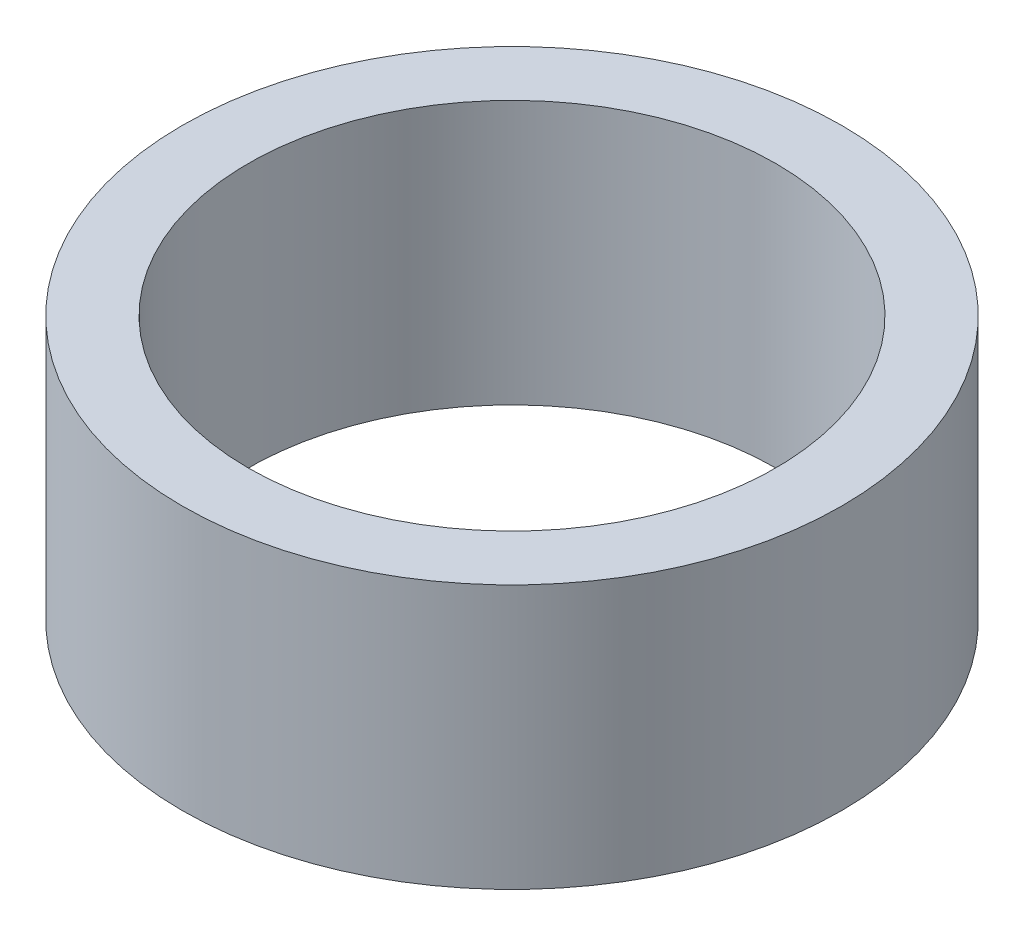
from build123d import *

# Parameters (mm, degrees)
SKETCH1_R           = 63.5
BOSS_EXTRUDE1_DEPTH = 50.8
SKETCH2_R           = 50.8
CUT_EXTRUDE1_DEPTH  = 104.175287739


with BuildPart() as part:
    # Sketch1 → Boss-Extrude1 (new body)
    with BuildSketch(Plane(origin=(0, 0, 0), x_dir=(1, 0, 0), z_dir=(0, 1, 0))):
        with Locations(Location((0, 0, 0), (0, 0, 270))):
            Circle(SKETCH1_R)
    extrude(amount=BOSS_EXTRUDE1_DEPTH)

    # Sketch2 → Cut-Extrude1 (cut, through all)
    with BuildSketch(Plane(origin=(0, 50.8, 0), x_dir=(1, 0, 0), z_dir=(0, 1, 0))):
        with Locations(Location((0, 0, 0), (0, 0, 270))):
            Circle(SKETCH2_R)
    extrude(amount=-CUT_EXTRUDE1_DEPTH, mode=Mode.SUBTRACT)


solid = part.part
